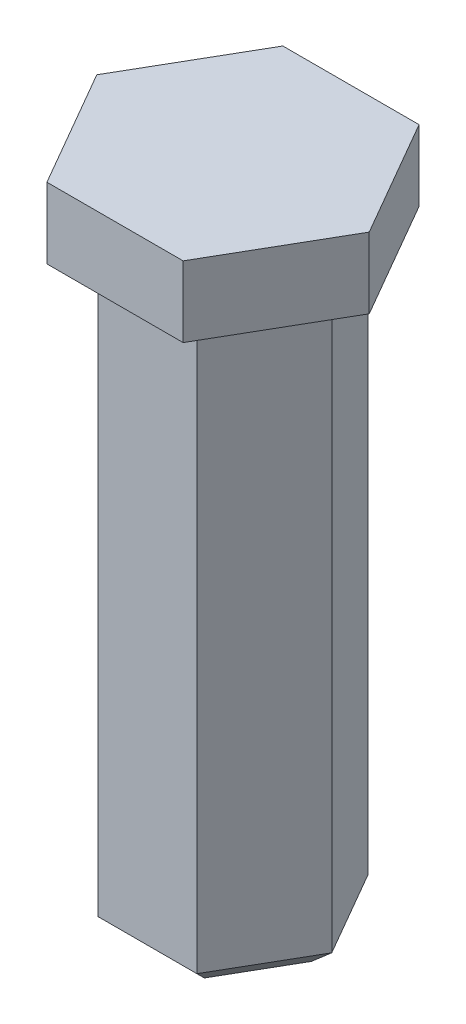
from build123d import *

# Parameters (mm, degrees)
BOSS_EXTRUDE1_DEPTH = 10
BOSS_EXTRUDE2_DEPTH = 1.2
CHAMFER1_SIZE       = 0.3


with BuildPart() as part:
    # Sketch1 → Boss-Extrude1 (new body)
    with BuildSketch(Plane(origin=(0, 0, 0), x_dir=(1, 0, 0), z_dir=(0, 1, 0))):
        Polygon((1.674315781, 0), (0.83715789, 1.45), (-0.83715789, 1.45), (-1.674315781, 0), (-0.83715789, -1.45), (0.83715789, -1.45), align=None)
    extrude(amount=BOSS_EXTRUDE1_DEPTH)

    # Sketch2 → Boss-Extrude2 (add)
    with BuildSketch(Plane(origin=(0, 10, 0), x_dir=(1, 0, 0), z_dir=(0, 1, 0))):
        Polygon((2.309401077, 0), (1.154700538, 2), (-1.154700538, 2), (-2.309401077, 0), (-1.154700538, -2), (1.154700538, -2), align=None)
    extrude(amount=BOSS_EXTRUDE2_DEPTH)

    # Chamfer1
    chamfer1_edges = [part.edges().sort_by_distance(p)[0] for p in [
        (0, 0, 1.45),
        (-1.255736835, 0, 0.725),
        (-1.255736835, 0, -0.725),
        (0, 0, -1.45),
        (1.255736835, 0, -0.725),
        (1.255736835, 0, 0.725),
    ]]
    chamfer(chamfer1_edges, length=CHAMFER1_SIZE)


solid = part.part
